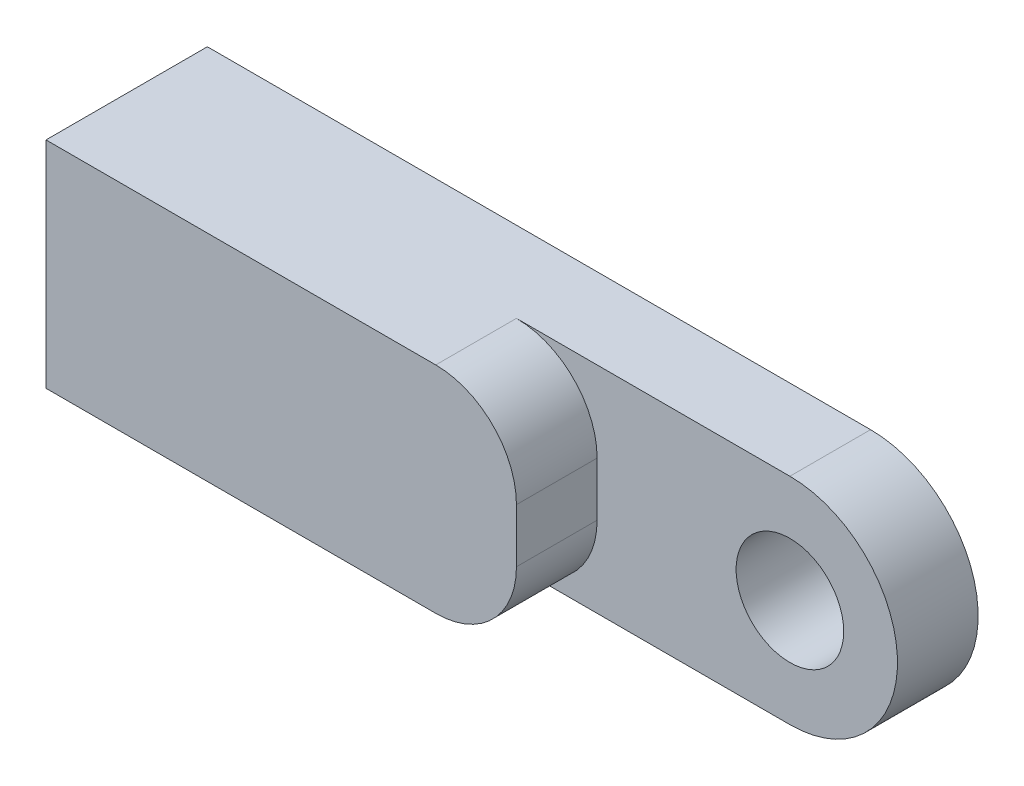
from build123d import *

# Parameters (mm, degrees)
SKETCH1_R           = 20
BOSS_EXTRUDE1_DEPTH = 60
SKETCH2_R           = 45
CUT_EXTRUDE1_DEPTH  = 30
CUT_EXTRUDE2_DEPTH  = 131
SKETCH4_R           = 7.5
CUT_EXTRUDE3_DEPTH  = 10
SKETCH5_W           = 53.741916818
SKETCH5_H           = 80
CUT_EXTRUDE7_DEPTH  = 30
FILLET1_R           = 30


with BuildPart() as part:
    # Sketch1 → Boss-Extrude1 (new body)
    with BuildSketch(Plane.XY):
        with BuildLine():
            Line((-150, 40), (125, 40))
            ThreePointArc((125, 40), (165, 0), (125, -40))
            Line((125, -40), (-150, -40))
            ThreePointArc((-150, -40), (-190, 0), (-150, 40))
        make_face()
        with Locations((-150, 0)):
            Circle(SKETCH1_R, mode=Mode.SUBTRACT)
        with Locations((125, 0)):
            Circle(SKETCH1_R, mode=Mode.SUBTRACT)
    extrude(amount=BOSS_EXTRUDE1_DEPTH)

    # Sketch2 → Cut-Extrude1 (cut)
    with BuildSketch(Plane.XY.offset(60)):
        with Locations((125, 0)):
            Circle(SKETCH2_R)
    extrude(amount=-CUT_EXTRUDE1_DEPTH, mode=Mode.SUBTRACT)

    # Sketch3 → Cut-Extrude2 (cut)
    with BuildSketch(Plane.XZ.offset(40)):
        Polygon((-150, 60), (-210.17287427, 60), (-210.17287427, 0), (-121.61196852, 0), (-121.61196852, 60), (-130, 60), align=None)
    extrude(amount=-CUT_EXTRUDE2_DEPTH, mode=Mode.SUBTRACT)

    # Sketch4 → Cut-Extrude3 (cut)
    with BuildSketch(Plane.ZY.offset(121.61196852)):
        with Locations((30, 0)):
            Circle(SKETCH4_R)
    extrude(amount=-CUT_EXTRUDE3_DEPTH, mode=Mode.SUBTRACT)

    # Sketch5 → Cut-Extrude7 (cut)
    with BuildSketch(Plane.XY.offset(60)):
        with Locations((80.186599238, 0)):
            Rectangle(SKETCH5_W, SKETCH5_H)
    extrude(amount=-CUT_EXTRUDE7_DEPTH, mode=Mode.SUBTRACT)

    # Fillet1
    fillet1_edges = [part.edges().sort_by_distance(p)[0] for p in [
        (53.315640829, 40, 45),
        (53.315640829, -40, 45),
    ]]
    fillet(fillet1_edges, radius=FILLET1_R)


solid = part.part
